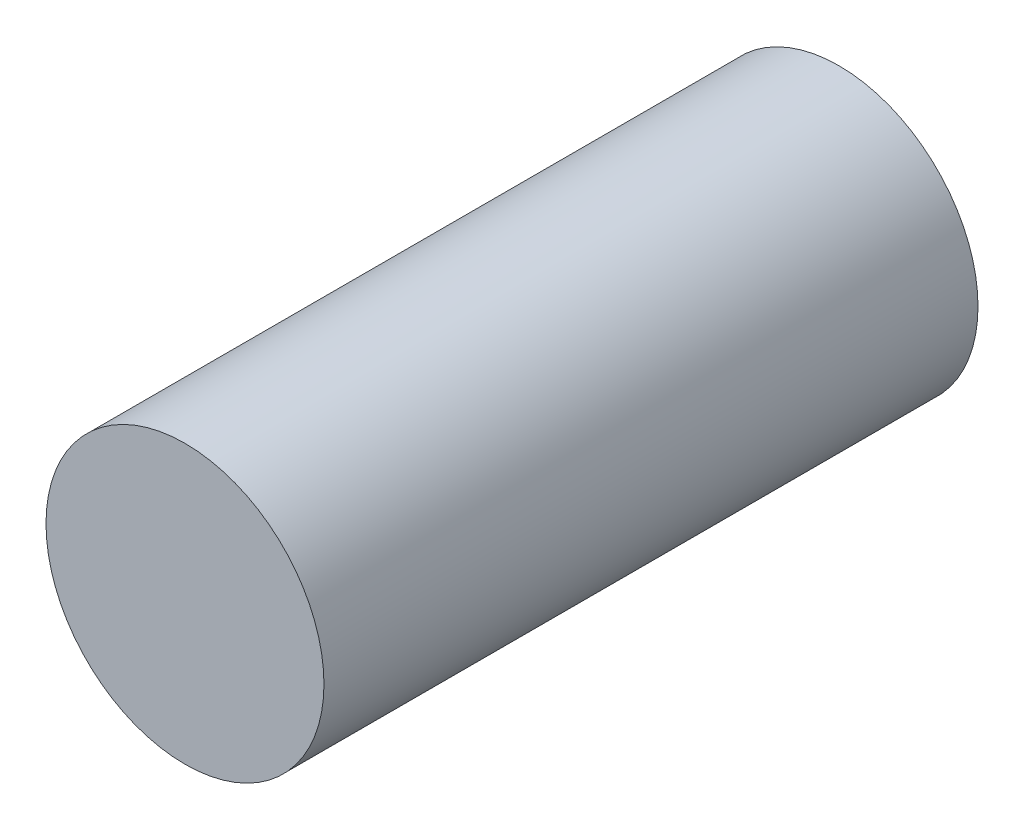
from build123d import *

# Parameters (mm, degrees)
BOSS_EXTRUDE1_DEPTH      = 7
BOSS_EXTRUDE1_DEPTH_BACK = 1
SKETCH1_R                = 1.7


with BuildPart() as part:
    # Sketch1 → Boss-Extrude1 (new, two sides: drawn at the far end of the back side and taken through both)
    with BuildSketch(Plane.XY.offset(-BOSS_EXTRUDE1_DEPTH_BACK)):
        with Locations((-56.34885412, 15.37455153)):
            Circle(SKETCH1_R)
    extrude(amount=BOSS_EXTRUDE1_DEPTH + BOSS_EXTRUDE1_DEPTH_BACK)


solid = part.part
